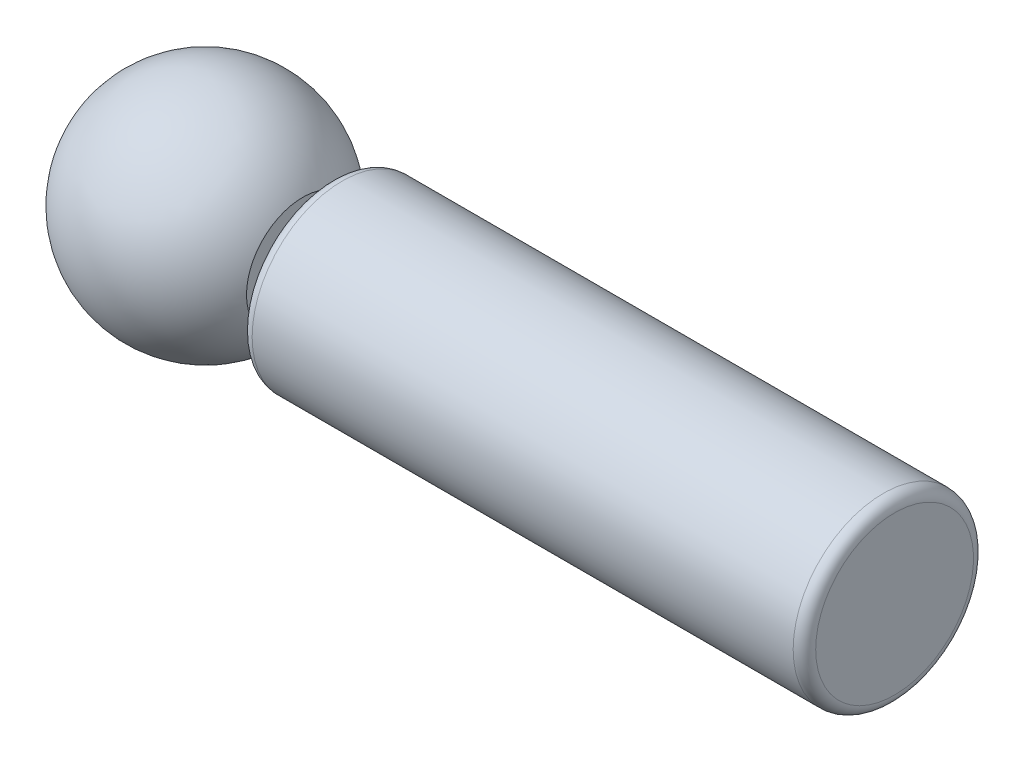
from build123d import *

# Parameters (mm, degrees)
FILLET1_R = 1


with BuildPart() as part:
    # Sketch1 → Revolve1 (revolve)
    with BuildSketch(Plane(origin=(0, 0, 0), x_dir=(1, 0, 0), z_dir=(0, 1, 0)), mode=Mode.PRIVATE) as revolve1_sk:
        with BuildLine():
            Line((0, 0), (61.160254038, 0))
            Line((61.160254038, 0), (61.160254038, 8))
            Line((61.160254038, 8), (11.160254038, 8))
            Line((11.160254038, 8), (11.160254038, 3.5))
            ThreePointArc((11.160254038, 3.5), (10.940584124, 2.969669914), (10.410254038, 2.75))
            Line((10.410254038, 2.75), (9.410254038, 2.75))
            ThreePointArc((9.410254038, 2.75), (8.879923952, 2.969669914), (8.660254038, 3.5))
            Line((8.660254038, 3.5), (8.660254038, 5))
            ThreePointArc((8.660254038, 5), (-2.588190451, 9.659258263), (-10, 0))
            Line((-10, 0), (0, 0))
        make_face()
    revolve(revolve1_sk.sketch.rotate(Axis((0, 0, 0), (1, 0, 0)), 180), axis=Axis((0, 0, 0), (1, 0, 0)))

    # Fillet1
    fillet1_edges = [part.edges().sort_by_distance(p)[0] for p in [
        (61.160254038, 0, -8),
        (11.160254038, 0, -8),
    ]]
    fillet(fillet1_edges, radius=FILLET1_R)


solid = part.part
